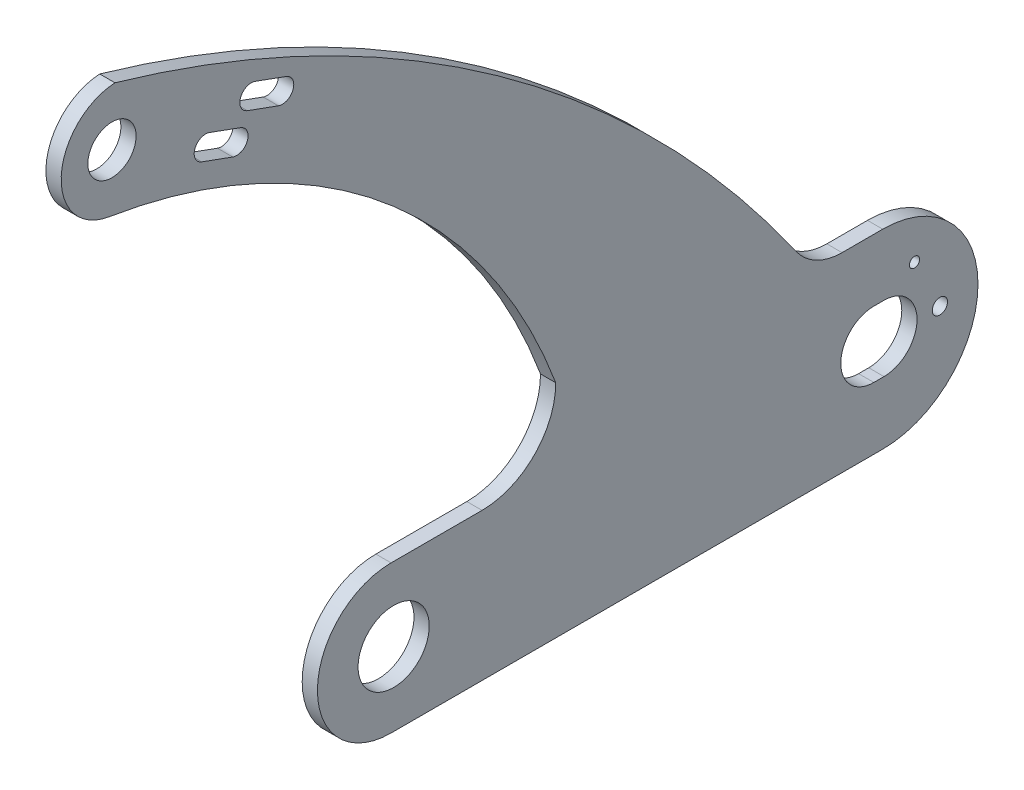
from build123d import *

# Parameters (mm, degrees)
SKETCH1_R           = 1.5
SKETCH1_R_2         = 1
SKETCH1_R_3         = 7
SKETCH1_R_4         = 4.75
BOSS_EXTRUDE1_DEPTH = 3


with BuildPart() as part:
    # Sketch1 → Boss-Extrude1 (new body)
    with BuildSketch(Plane(origin=(0, 0, 0), x_dir=(0, 0, -1), z_dir=(1, 0, 0))):
        with BuildLine():
            Line((-48.375, 0), (48.375, 0))
            ThreePointArc((48.375, 0), (67.125, 18.75), (48.375, 37.5))
            Line((48.375, 37.5), (40.375, 37.5))
            ThreePointArc((40.375, 37.5), (35.295765254, 38.742880835), (31.364327513, 42.1906592))
            ThreePointArc((31.364327513, 42.1906592), (-27.467628368, 101.587088748), (-102.722095146, 138))
            ThreePointArc((-102.722095146, 138), (-113.291936406, 127.38864025), (-103.88918697, 115.730561375))
            ThreePointArc((-103.88918697, 115.730561375), (-50.193524878, 91.468412174), (-15.975, 43.5))
            ThreePointArc((-15.975, 43.5), (-20.221951673, 33.246951673), (-30.475, 29))
            Line((-30.475, 29), (-48.375, 29))
            ThreePointArc((-48.375, 29), (-62.875, 14.5), (-48.375, 0))
        make_face()
        with Locations((59.625, 18.75)):
            Circle(SKETCH1_R, mode=Mode.SUBTRACT)
        with Locations((54.625, 28.75)):
            Circle(SKETCH1_R_2, mode=Mode.SUBTRACT)
        with Locations((-47.875, 14.5)):
            Circle(SKETCH1_R_3, mode=Mode.SUBTRACT)
        with Locations((-103.305641058, 126.865280687)):
            Circle(SKETCH1_R_4, mode=Mode.SUBTRACT)
        with BuildLine():
            Line((-84.112179989, 120.210043762), (-78.004177954, 117.98691283))
            ThreePointArc((-78.004177954, 117.98691283), (-76.659414879, 115.103059111), (-79.543268599, 113.758296037))
            Line((-79.543268599, 113.758296037), (-85.651270634, 115.981426968))
            ThreePointArc((-85.651270634, 115.981426968), (-86.996033708, 118.865280687), (-84.112179989, 120.210043762))
        make_face(mode=Mode.SUBTRACT)
        with BuildLine():
            Line((-75.120324234, 124.438660555), (-69.012322199, 122.215529624))
            ThreePointArc((-69.012322199, 122.215529624), (-67.667559125, 119.331675904), (-70.551412844, 117.98691283))
            Line((-70.551412844, 117.98691283), (-76.659414879, 120.210043762))
            ThreePointArc((-76.659414879, 120.210043762), (-78.004177954, 123.093897481), (-75.120324234, 124.438660555))
        make_face(mode=Mode.SUBTRACT)
        with BuildLine():
            Line((46.625, 25.25), (48.625, 25.25))
            ThreePointArc((48.625, 25.25), (55.125, 18.75), (48.625, 12.25))
            Line((48.625, 12.25), (46.625, 12.25))
            ThreePointArc((46.625, 12.25), (40.125, 18.75), (46.625, 25.25))
        make_face(mode=Mode.SUBTRACT)
    extrude(amount=BOSS_EXTRUDE1_DEPTH)


solid = part.part
